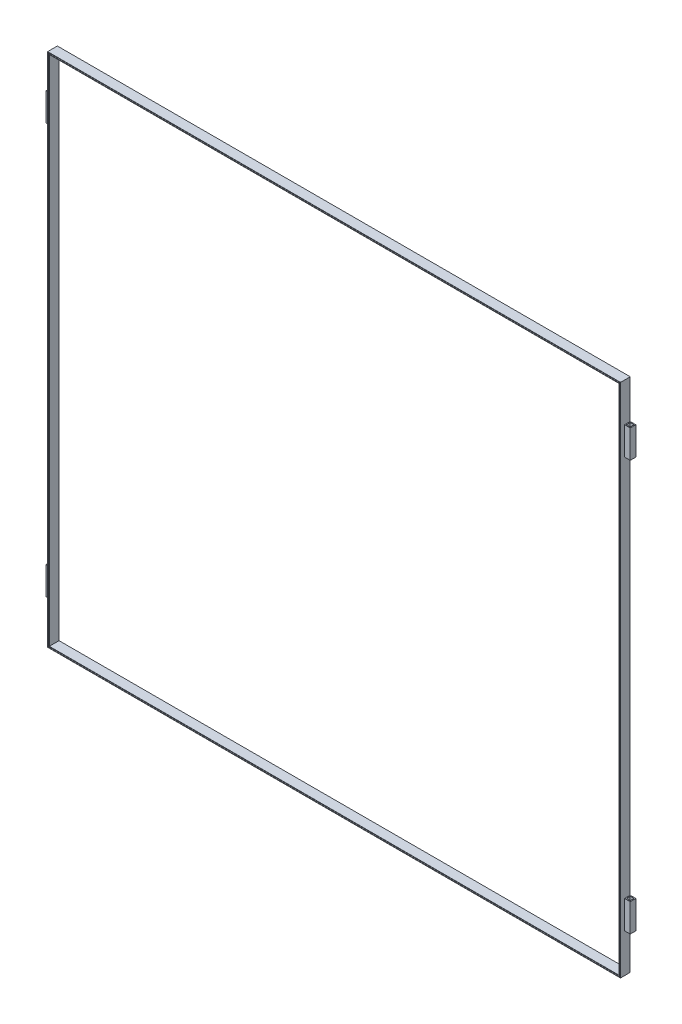
from build123d import *

# Parameters (mm, degrees)
SKETCH1_W               = 3058
SKETCH1_H               = 2753.2
SKETCH1_W_2             = 3048
SKETCH1_H_2             = 2743.2
BOSS_EXTRUDE1_DEPTH     = 50
SHELL4_T                = 2
SKETCH2_W               = 3058
SKETCH2_H               = 2753.2
SKETCH2_W_2             = 3048
SKETCH2_H_2             = 2743.2
CUT_EXTRUDE5_DEPTH      = 5
SKETCH3_W               = 30
SKETCH3_H               = 150
BOSS_EXTRUDE2_DEPTH     = 30
SKETCH4_W               = 20
SKETCH4_H               = 20
CUT_EXTRUDE6_DEPTH      = 100
SKETCH5_W               = 20
SKETCH5_H               = 20
CUT_EXTRUDE7_DEPTH      = 100
MIRROR2_COPY_1_SKETCH_W = 30
MIRROR2_COPY_1_SKETCH_H = 150
MIRROR2_COPY_1_DEPTH    = 30
SKETCH6_R               = 5
CUT_EXTRUDE8_DEPTH      = 2490
SKETCH7_W               = 52
SKETCH7_H               = 7
BOSS_EXTRUDE3_DEPTH     = 2
MIRROR5_COPY_1_SKETCH_W = 52
MIRROR5_COPY_1_SKETCH_H = 7
MIRROR5_COPY_1_DEPTH    = 2


with BuildPart() as part:
    # Sketch1 → Boss-Extrude1 (new body)
    with BuildSketch(Plane.XY):
        Rectangle(SKETCH1_W, SKETCH1_H)
        Rectangle(SKETCH1_W_2, SKETCH1_H_2, mode=Mode.SUBTRACT)
    extrude(amount=BOSS_EXTRUDE1_DEPTH)

    # Shell4
    shell4_openings = [part.faces().sort_by_distance(p)[0] for p in [
        (-1524.885212735, 0, 50),
    ]]
    offset(amount=SHELL4_T, openings=shell4_openings, kind=Kind.INTERSECTION)

    # Sketch2 → Cut-Extrude5 (cut, symmetric)
    with BuildSketch(Plane.XY):
        Rectangle(SKETCH2_W, SKETCH2_H)
        Rectangle(SKETCH2_W_2, SKETCH2_H_2, mode=Mode.SUBTRACT)
    extrude(amount=CUT_EXTRUDE5_DEPTH, both=True, mode=Mode.SUBTRACT)


with BuildPart() as cut_extrude5_piece_1:
    # of the separate pieces the step leaves, piece 1, a body of its own (cut_extrude5_pieces)
    add(part.part.solids().sort_by_distance((-1529, -1376.6, -2))[0])

    # Sketch3 → Boss-Extrude2 (add)
    with BuildSketch(Plane(origin=(1531, 0, 0), x_dir=(0, 0, -1), z_dir=(1, 0, 0))):
        with Locations((-13, 1096.4)):
            Rectangle(SKETCH3_W, SKETCH3_H)
    boss_extrude2 = extrude(amount=BOSS_EXTRUDE2_DEPTH)

    # Sketch4 → Cut-Extrude6 (cut)
    with BuildSketch(Plane(origin=(0, 1171.4, 0), x_dir=(1, 0, 0), z_dir=(0, 1, 0))):
        with Locations((1546, -13)):
            Rectangle(SKETCH4_W, SKETCH4_H)
    cut_extrude6 = extrude(amount=-CUT_EXTRUDE6_DEPTH, mode=Mode.SUBTRACT)

    # Mirror1: Boss-Extrude2 across plane
    add(boss_extrude2.mirror(Plane.ZX))

    # Sketch5 → Cut-Extrude7 (cut)
    with BuildSketch(Plane(origin=(0, -1021.4, 0), x_dir=(1, 0, 0), z_dir=(0, 1, 0))):
        with Locations((1546, -13)):
            Rectangle(SKETCH5_W, SKETCH5_H)
    cut_extrude7 = extrude(amount=-CUT_EXTRUDE7_DEPTH, mode=Mode.SUBTRACT)

    # Mirror2: Boss-Extrude2 across plane
    add(boss_extrude2.mirror(Plane(origin=(0, 0, 0), x_dir=(0, 0, 1), z_dir=(1, 0, 0))))

    # Mirror2 copy 1 sketch → Mirror2 copy 1 (add)
    with BuildSketch(Plane(origin=(-1531, 0, 0), x_dir=(0, 0, -1), z_dir=(-1, 0, 0))):
        with Locations((-13, 1096.4)):
            Rectangle(MIRROR2_COPY_1_SKETCH_W, MIRROR2_COPY_1_SKETCH_H)
    extrude(amount=MIRROR2_COPY_1_DEPTH)

    # Mirror3: Cut-Extrude6, Cut-Extrude7 across plane
    add(cut_extrude6.mirror(Plane(origin=(0, 0, 0), x_dir=(0, 0, 1), z_dir=(1, 0, 0))), mode=Mode.SUBTRACT)
    add(cut_extrude7.mirror(Plane(origin=(0, 0, 0), x_dir=(0, 0, 1), z_dir=(1, 0, 0))), mode=Mode.SUBTRACT)

    # Sketch6 → Cut-Extrude8 (cut)
    with BuildSketch(Plane(origin=(0, 1071.4, 0), x_dir=(1, 0, 0), z_dir=(0, 1, 0))):
        with Locations(Location((1546, -13, 0), (0, 0, 270))):
            Circle(SKETCH6_R)
    extrude(amount=-CUT_EXTRUDE8_DEPTH, mode=Mode.SUBTRACT)



with BuildPart() as cut_extrude5_piece_2:
    # of the separate pieces the step leaves, piece 2, a body of its own (cut_extrude5_pieces)
    add(part.part.solids().sort_by_distance((-1524, 1371.6, -2))[0])


with BuildPart() as cut_extrude5_piece_1_1:
    add(cut_extrude5_piece_1.part)

    add(cut_extrude5_piece_2.part)  # Boss-Extrude3 merges Cut-Extrude5 piece 2
    # Sketch7 → Boss-Extrude3 (add)
    with BuildSketch(Plane(origin=(1524, 0, 0), x_dir=(0, 0, -1), z_dir=(1, 0, 0))):
        with Locations((-24, 1375.1)):
            Rectangle(SKETCH7_W, SKETCH7_H)
    boss_extrude3 = extrude(amount=-BOSS_EXTRUDE3_DEPTH)

    # Mirror4: Boss-Extrude3 across plane
    add(boss_extrude3.mirror(Plane.ZX))

    # Mirror5: Boss-Extrude3 across plane
    add(boss_extrude3.mirror(Plane(origin=(0, 0, 0), x_dir=(0, 0, 1), z_dir=(1, 0, 0))))

    # Mirror5 copy 1 sketch → Mirror5 copy 1 (add)
    with BuildSketch(Plane(origin=(-1524, 0, 0), x_dir=(0, 0, -1), z_dir=(-1, 0, 0))):
        with Locations((-24, 1375.1)):
            Rectangle(MIRROR5_COPY_1_SKETCH_W, MIRROR5_COPY_1_SKETCH_H)
    extrude(amount=-MIRROR5_COPY_1_DEPTH)


solid = cut_extrude5_piece_1_1.part
